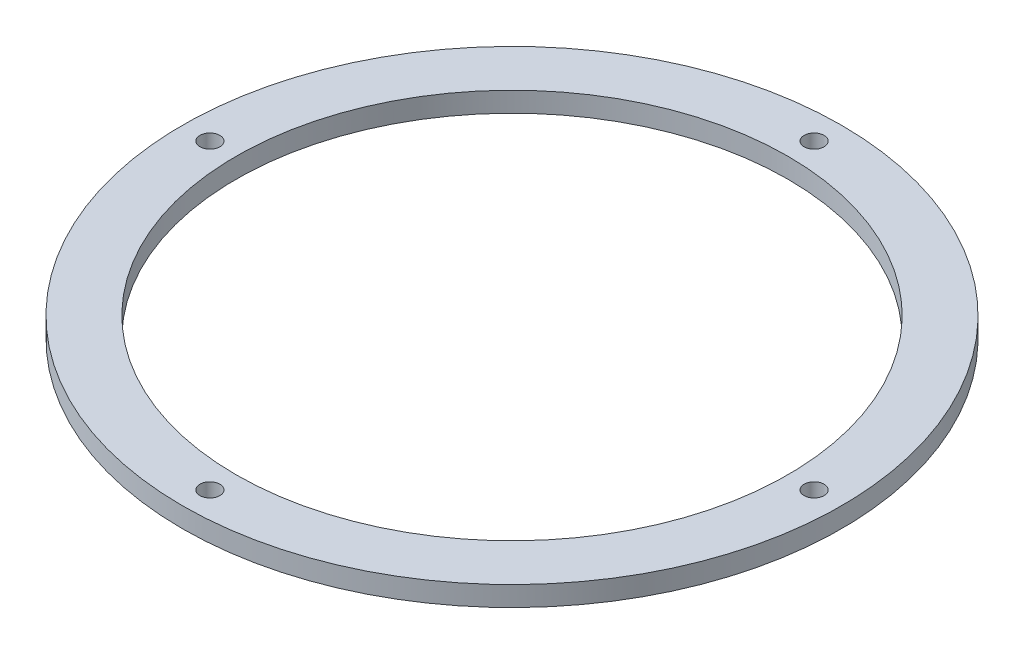
from build123d import *

# Parameters (mm, degrees)
SKETCH_1_R      = 86
SKETCH_1_R_2    = 72
SKETCH_1_R_3    = 2.6
EXTRUDE_1_DEPTH = 5.2


with BuildPart() as part:
    # 草图1 → 凸台-拉伸1 (new body)
    with BuildSketch(Plane(origin=(0, 0, 0), x_dir=(1, 0, 0), z_dir=(0, 1, 0))):
        with Locations(Location((0, 0, 0), (0, 0, 270))):
            Circle(SKETCH_1_R)
        with Locations(Location((0, 0, 0), (0, 0, 270))):
            Circle(SKETCH_1_R_2, mode=Mode.SUBTRACT)
        with Locations(Location((0, 78.83, 0), (0, 0, 270))):
            Circle(SKETCH_1_R_3, mode=Mode.SUBTRACT)
        with Locations(Location((78.83, 0, 0), (0, 0, 270))):
            Circle(SKETCH_1_R_3, mode=Mode.SUBTRACT)
        with Locations(Location((0, -78.83, 0), (0, 0, 270))):
            Circle(SKETCH_1_R_3, mode=Mode.SUBTRACT)
        with Locations(Location((-78.83, 0, 0), (0, 0, 270))):
            Circle(SKETCH_1_R_3, mode=Mode.SUBTRACT)
    extrude(amount=EXTRUDE_1_DEPTH)


solid = part.part
